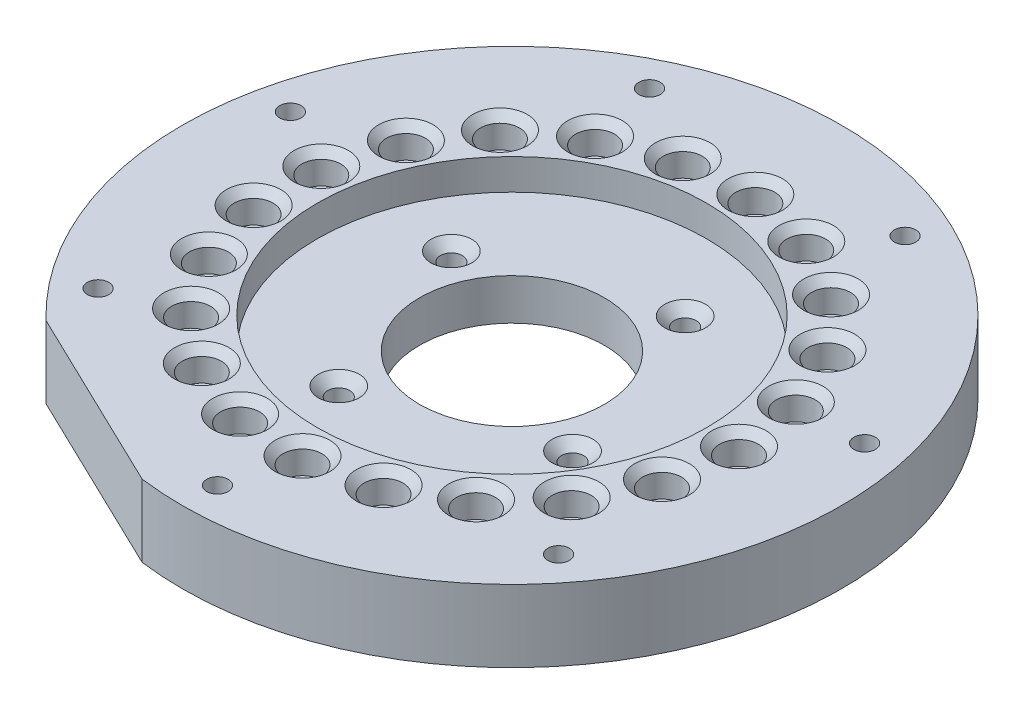
from build123d import *

# Parameters (mm, degrees)
SKETCH1_R                                       = 50.8
SKETCH1_R_2                                     = 19.25
BOSS_EXTRUDE1_DEPTH                             = 6.35
SKETCH2_R                                       = 50.8
SKETCH2_R_2                                     = 30
BOSS_EXTRUDE2_DEPTH                             = 4.7625
SKETCH3_R                                       = 3
CUT_EXTRUDE1_DEPTH                              = 4.7625
CHAMFER1_SIZE                                   = 1.2
M4X0_7_TAPPED_HOLE1_D                           = 3.3
M4X0_7_TAPPED_HOLE1_DEPTH                       = 11.1135
BOSS_EXTRUDE3_START                             = -6.35
SKETCH13_R                                      = 19.25
SKETCH13_R_2                                    = 14.25
BOSS_EXTRUDE3_DEPTH                             = 6.35
CSK_FOR_M3_FLAT_HEAD_MACHINE_SCREW1_D           = 3.4
CSK_FOR_M3_FLAT_HEAD_MACHINE_SCREW1_CSINK_D     = 6.3
CSK_FOR_M3_FLAT_HEAD_MACHINE_SCREW1_CSINK_ANGLE = 90
CUT_EXTRUDE4_DEPTH                              = 73.696407451
CUT_EXTRUDE4_DEPTH_BACK                         = 73.696407451


with BuildPart() as part:
    # Sketch1 → Boss-Extrude1 (new body)
    with BuildSketch(Plane(origin=(0, 0, 0), x_dir=(1, 0, 0), z_dir=(0, 1, 0))):
        with Locations(Location((0, 0, 0), (0, 0, 270))):
            Circle(SKETCH1_R)
        with Locations(Location((0, 0, 0), (0, 0, 270))):
            Circle(SKETCH1_R_2, mode=Mode.SUBTRACT)
    extrude(amount=BOSS_EXTRUDE1_DEPTH)

    # Sketch2 → Boss-Extrude2 (add)
    with BuildSketch(Plane(origin=(0, 6.35, 0), x_dir=(1, 0, 0), z_dir=(0, 1, 0))):
        with Locations(Location((0, 0, 0), (0, 0, 270))):
            Circle(SKETCH2_R)
        with Locations(Location((0, 0, 0), (0, 0, 90))):
            Circle(SKETCH2_R_2, mode=Mode.SUBTRACT)
    extrude(amount=BOSS_EXTRUDE2_DEPTH)

    # Sketch3 → Cut-Extrude1 (cut)
    with BuildSketch(Plane(origin=(0, 11.1125, 0), x_dir=(1, 0, 0), z_dir=(0, 1, 0))):
        with Locations(Location((35, 0, 0), (0, 0, 270))):
            Circle(SKETCH3_R)
        with Locations(Location((33.445048203, -10.316431104, 0), (0, 0, 270))):
            Circle(SKETCH3_R)
        with Locations(Location((28.918357101, -19.716202032, 0), (0, 0, 270))):
            Circle(SKETCH3_R)
        with Locations(Location((21.822143065, -27.364101886, 0), (0, 0, 270))):
            Circle(SKETCH3_R)
        with Locations(Location((12.786935853, -32.580581203, 0), (0, 0, 270))):
            Circle(SKETCH3_R)
        with Locations(Location((2.615553276, -34.902132901, 0), (0, 0, 270))):
            Circle(SKETCH3_R)
        with Locations(Location((-7.788232688, -34.122476926, 0), (0, 0, 270))):
            Circle(SKETCH3_R)
        with Locations(Location((-17.5, -30.310889132, 0), (0, 0, 270))):
            Circle(SKETCH3_R)
        with Locations(Location((-25.656815514, -23.806045822, 0), (0, 0, 270))):
            Circle(SKETCH3_R)
        with Locations(Location((-31.533910377, -15.185930869, 0), (0, 0, 270))):
            Circle(SKETCH3_R)
        with Locations(Location((-34.609078918, -5.216479316, 0), (0, 0, 270))):
            Circle(SKETCH3_R)
        with Locations(Location((-34.609078918, 5.216479316, 0), (0, 0, 270))):
            Circle(SKETCH3_R)
        with Locations(Location((-31.533910377, 15.185930869, 0), (0, 0, 270))):
            Circle(SKETCH3_R)
        with Locations(Location((-25.656815514, 23.806045822, 0), (0, 0, 270))):
            Circle(SKETCH3_R)
        with Locations(Location((-17.5, 30.310889132, 0), (0, 0, 270))):
            Circle(SKETCH3_R)
        with Locations(Location((-7.788232688, 34.122476926, 0), (0, 0, 270))):
            Circle(SKETCH3_R)
        with Locations(Location((2.615553276, 34.902132901, 0), (0, 0, 270))):
            Circle(SKETCH3_R)
        with Locations(Location((12.786935853, 32.580581203, 0), (0, 0, 270))):
            Circle(SKETCH3_R)
        with Locations(Location((21.822143065, 27.364101886, 0), (0, 0, 270))):
            Circle(SKETCH3_R)
        with Locations(Location((28.918357101, 19.716202032, 0), (0, 0, 270))):
            Circle(SKETCH3_R)
        with Locations(Location((33.445048203, 10.316431104, 0), (0, 0, 270))):
            Circle(SKETCH3_R)
    extrude(amount=-CUT_EXTRUDE1_DEPTH, mode=Mode.SUBTRACT)

    # Chamfer1
    chamfer1_edges = [part.edges().sort_by_distance(p)[0] for p in [
        (2.615553276, 11.1125, 31.902132901),
        (12.786935853, 11.1125, 29.580581203),
        (21.822143065, 11.1125, 24.364101886),
        (28.918357101, 11.1125, 16.716202032),
        (33.445048203, 11.1125, 7.316431104),
        (35, 11.1125, -3),
        (33.445048203, 11.1125, -13.316431104),
        (28.918357101, 11.1125, -22.716202032),
        (21.822143065, 11.1125, -30.364101886),
        (12.786935853, 11.1125, -35.580581203),
        (2.615553276, 11.1125, -37.902132901),
        (-7.788232688, 11.1125, -37.122476926),
        (-17.5, 11.1125, -33.310889132),
        (-25.656815514, 11.1125, -26.806045822),
        (-31.533910377, 11.1125, -18.185930869),
        (-34.609078918, 11.1125, -8.216479316),
        (-7.788232688, 11.1125, 31.122476926),
        (-17.5, 11.1125, 27.310889132),
        (-25.656815514, 11.1125, 20.806045822),
        (-31.533910377, 11.1125, 12.185930869),
        (-34.609078918, 11.1125, 2.216479316),
    ]]
    chamfer(chamfer1_edges, length=CHAMFER1_SIZE)

    # M4x0.7 Tapped Hole1
    with Locations(Plane(origin=(0, 11.1125, 0), x_dir=(1, 0, 0), z_dir=(0, 1, 0))):
        with Locations((0, -45.4), (0, 0), (-19.698321756, 40.903986603), (19.698321756, 40.903986603), (44.261727213, 10.102450402), (35.495149304, -28.306437004), (-35.495149304, -28.306437004), (-44.261727213, 10.102450402)):
            Hole(M4X0_7_TAPPED_HOLE1_D / 2, depth=M4X0_7_TAPPED_HOLE1_DEPTH)

    # Sketch13 → Boss-Extrude3 (add)
    with BuildSketch(Plane(origin=(0, 6.35, 0), x_dir=(1, 0, 0), z_dir=(0, 1, 0)).offset(BOSS_EXTRUDE3_START)):
        Circle(SKETCH13_R)
        with Locations(Location((0, 0, 0), (0, 0, 270))):
            Circle(SKETCH13_R_2, mode=Mode.SUBTRACT)
    extrude(amount=BOSS_EXTRUDE3_DEPTH)

    # CSK for M3 Flat Head Machine Screw1 (through all)
    with Locations(Plane(origin=(0, 6.35, 0), x_dir=(1, 0, 0), z_dir=(0, 1, 0))):
        with Locations((8.677674782, 18.019377358), (-18.019377358, 8.677674782), (18.019377358, -8.677674782), (-8.677674782, -18.019377358)):
            CounterSinkHole(CSK_FOR_M3_FLAT_HEAD_MACHINE_SCREW1_D / 2, CSK_FOR_M3_FLAT_HEAD_MACHINE_SCREW1_CSINK_D / 2, counter_sink_angle=CSK_FOR_M3_FLAT_HEAD_MACHINE_SCREW1_CSINK_ANGLE)

    # Sketch16 → Cut-Extrude4 (cut, two sides: drawn at the far end of the back side and taken through both)
    with BuildSketch(Plane(origin=(0, 11.1125, 0), x_dir=(1, 0, 0), z_dir=(0, 1, 0)).offset(-CUT_EXTRUDE4_DEPTH_BACK)):
        Polygon((-20.93922925, -43.480757565), (12.568971471, -59.617456554), (3.715578601, -78.001716282), (-56.57071251, -48.969368621), (-47.717319639, -30.585108893), align=None)
    extrude(amount=CUT_EXTRUDE4_DEPTH + CUT_EXTRUDE4_DEPTH_BACK, mode=Mode.SUBTRACT)


solid = part.part
